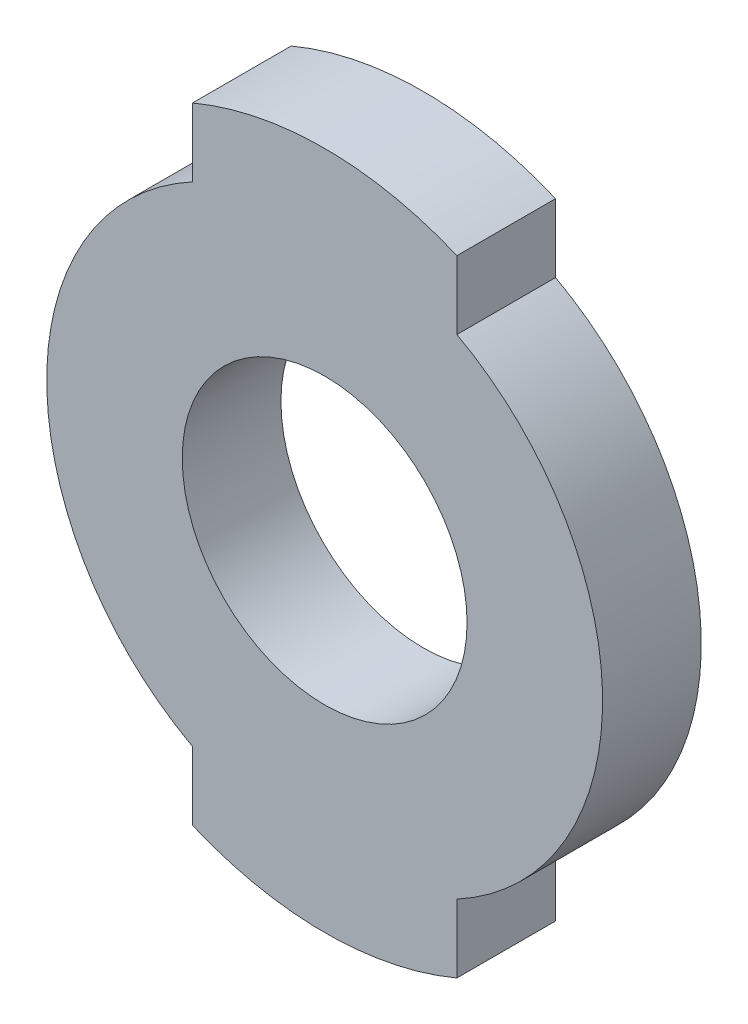
from build123d import *

# Parameters (mm, degrees)
IZIM1_R                     = 20.65
Y_KSEKLIK_EKSTR_ZYON1_DEPTH = 6
KES_EKSTR_ZYON1_START       = -6
KES_EKSTR_ZYON1_DEPTH       = 6
IZIM4_R                     = 8.66
KES_EKSTR_ZYON2_DEPTH       = 6


with BuildPart() as part:
    # Çizim1 → Yükseklik-Ekstrüzyon1 (new body)
    with BuildSketch(Plane.XY):
        Circle(IZIM1_R)
    extrude(amount=Y_KSEKLIK_EKSTR_ZYON1_DEPTH)

    # Çizim3 → Kes-Ekstrüzyon1 (cut)
    with BuildSketch(Plane.XY.offset(6).offset(KES_EKSTR_ZYON1_START)):
        with BuildLine():
            Line((8.04, 14.865005886), (8.04, 19.020538899))
            ThreePointArc((8.04, 19.020538899), (20.65, 0), (8.04, -19.020538899))
            Line((8.04, -19.020538899), (8.04, -14.865005886))
            ThreePointArc((8.04, -14.865005886), (16.9, 0), (8.04, 14.865005886))
        make_face()
        with BuildLine():
            Line((-8.04, 14.865005886), (-8.04, 19.020538899))
            ThreePointArc((-8.04, 19.020538899), (-20.65, 0), (-8.04, -19.020538899))
            Line((-8.04, -19.020538899), (-8.04, -14.865005886))
            ThreePointArc((-8.04, -14.865005886), (-16.9, 0), (-8.04, 14.865005886))
        make_face()
    extrude(amount=KES_EKSTR_ZYON1_DEPTH, mode=Mode.SUBTRACT)

    # Çizim4 → Kes-Ekstrüzyon2 (cut)
    with BuildSketch(Plane.XY.offset(6)):
        Circle(IZIM4_R)
    extrude(amount=-KES_EKSTR_ZYON2_DEPTH, mode=Mode.SUBTRACT)


solid = part.part
